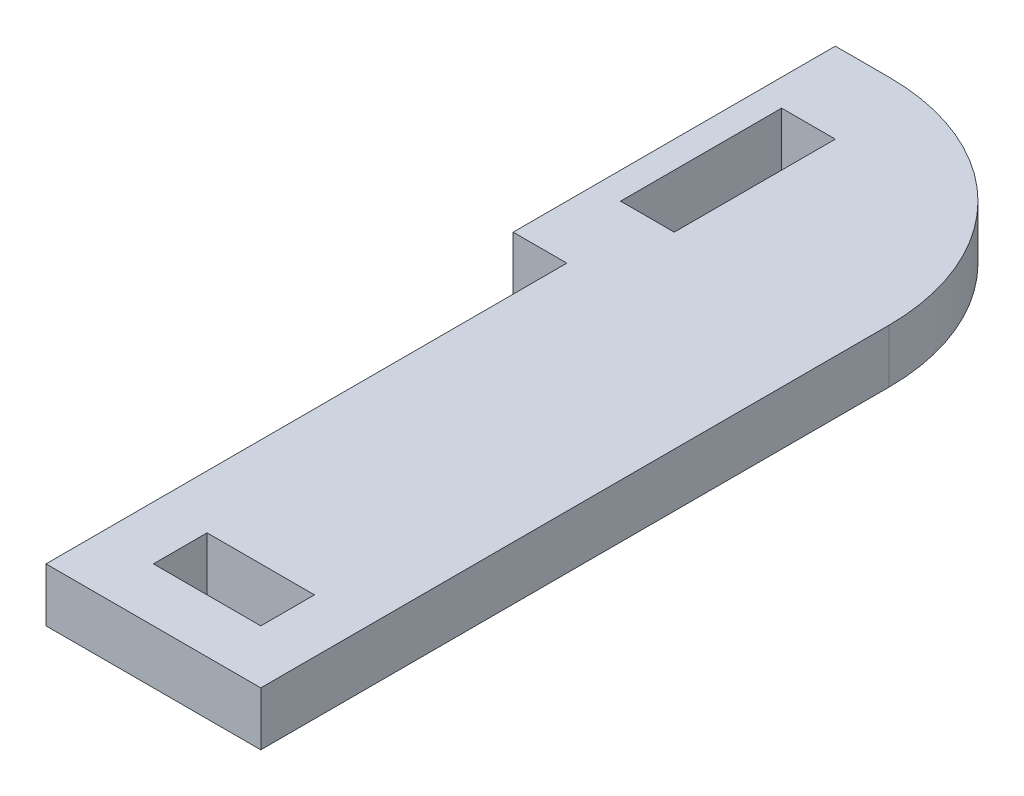
from build123d import *

# Parameters (mm, degrees)
SKETCH1_W           = 10
SKETCH1_H           = 5
SKETCH1_W_2         = 5
SKETCH1_H_2         = 15
BOSS_EXTRUDE1_DEPTH = 5
FILLET2_R           = 20


with BuildPart() as part:
    # Sketch1 → Boss-Extrude1 (new body)
    with BuildSketch(Plane(origin=(0, 0, 0), x_dir=(1, 0, 0), z_dir=(0, 1, 0))):
        Polygon((-30.064538889, 111.027213551), (-25.064538889, 111.027213551), (-25.064538889, 62.527213551), (-5.064538889, 62.527213551), (-5.064538889, 141.027213551), (-30.064538889, 141.027213551), align=None)
        with Locations((-15.064538889, 70.027213551)):
            Rectangle(SKETCH1_W, SKETCH1_H, mode=Mode.SUBTRACT)
        with Locations((-25.064538889, 126.027213551)):
            Rectangle(SKETCH1_W_2, SKETCH1_H_2, mode=Mode.SUBTRACT)
    extrude(amount=BOSS_EXTRUDE1_DEPTH)

    # Fillet2
    fillet2_edges = [part.edges().sort_by_distance(p)[0] for p in [
        (-5.064538889, 2.5, -141.027213551),
    ]]
    fillet(fillet2_edges, radius=FILLET2_R)


solid = part.part
